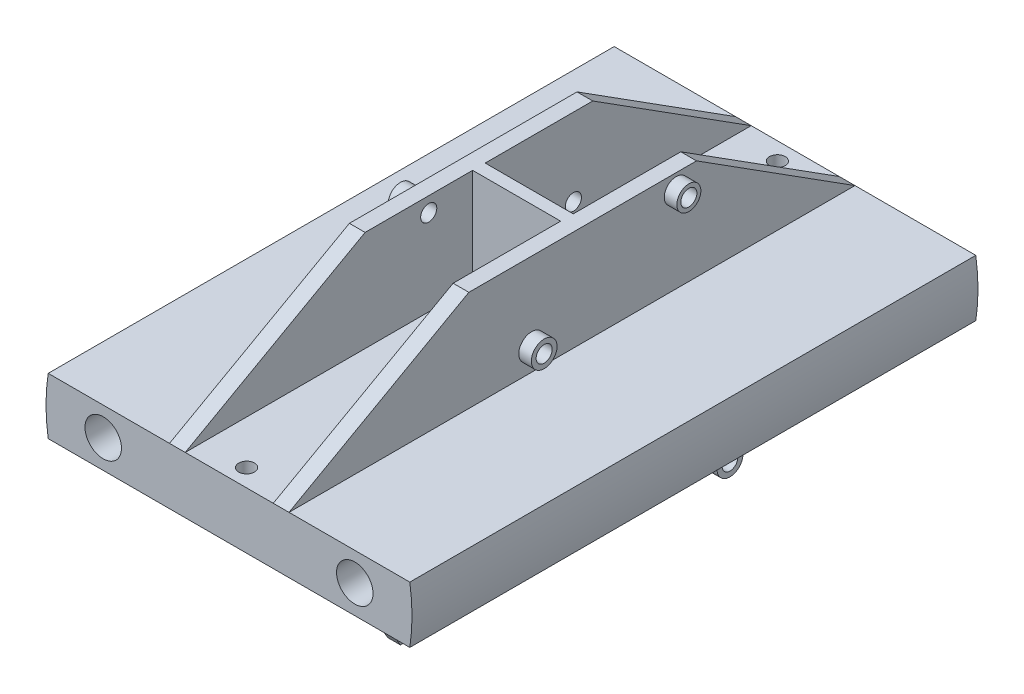
from build123d import *

# Parameters (mm, degrees)
SKETCH1_R            = 5.715
SKETCH1_R_2          = 3.683
BOSS_EXTRUDE2_DEPTH  = 114.3
SKETCH2_W            = 3.175
SKETCH2_H            = 45.974
BOSS_EXTRUDE3_DEPTH  = 20.32
SKETCH8_W            = 17.78
SKETCH8_H            = 2.54
BOSS_EXTRUDE6_DEPTH  = 20.32
BOSS_EXTRUDE9_DEPTH  = 20.32
CUT_EXTRUDE5_REACH   = 130.614
SKETCH10_R           = 1.5875
CUT_EXTRUDE6_REACH   = 126.596
SKETCH13_R           = 1.5875
BOSS_EXTRUDE14_DEPTH = 3.175
BOSS_EXTRUDE15_DEPTH = 3.175
BOSS_EXTRUDE16_START = 5.08
SKETCH12_R           = 2.590347575
SKETCH12_R_2         = 1.5875
SKETCH12_R_3         = 2.612210891
BOSS_EXTRUDE16_DEPTH = 5.08
CHAMFER1_SIZE        = 2.54
SKETCH21_R           = 1.6256
CUT_EXTRUDE7_DEPTH   = 5.08
SKETCH22_R           = 1.6256
CUT_EXTRUDE8_DEPTH   = 5.08
BOSS_EXTRUDE17_START = 2.54
SKETCH23_R           = 2.426614549
SKETCH23_R_2         = 1.6256
SKETCH23_R_3         = 2.598483989
BOSS_EXTRUDE17_DEPTH = 2.54
BOSS_EXTRUDE18_START = 2.54
SKETCH24_R           = 2.467964506
SKETCH24_R_2         = 1.6256
SKETCH24_R_3         = 2.533270714
BOSS_EXTRUDE18_DEPTH = 2.54
SKETCH25_R           = 48.771557558
SKETCH25_R_2         = 36.957
CUT_EXTRUDE9_DEPTH   = 124.263624906
CUT_EXTRUDE10_DEPTH  = 129.148442846


with BuildPart() as part:
    # Sketch1 → Boss-Extrude2 (new body)
    # profile 1 of 8: a face of its own
    with BuildSketch(Plane.XY):
        with BuildLine():
            Line((25.4, 5.715), (-25.4, 5.715))
            ThreePointArc((-25.4, 5.715), (-21.358884746, 4.041115254), (-19.685, 0))
            Line((-19.685, 0), (19.685, 0))
            ThreePointArc((19.685, 0), (21.358884746, 4.041115254), (25.4, 5.715))
        make_face()
    # profile 2 of 8: a face of its own
    with BuildSketch(Plane.XY):
        with Locations((-25.4, 0)):
            Circle(SKETCH1_R)
        with Locations((-25.4, 0)):
            Circle(SKETCH1_R_2, mode=Mode.SUBTRACT)
    # profile 3 of 8: a face of its own
    with BuildSketch(Plane.XY):
        with Locations((25.4, 0)):
            Circle(SKETCH1_R)
        with Locations((25.4, 0)):
            Circle(SKETCH1_R_2, mode=Mode.SUBTRACT)
    # profile 4 of 8: a face of its own
    with BuildSketch(Plane.XY):
        with BuildLine():
            ThreePointArc((-31.115, 0), (-29.441115254, 4.041115254), (-25.4, 5.715))
            Line((-25.4, 5.715), (-37.668936473, 5.715))
            ThreePointArc((-37.668936473, 5.715), (-37.992081278, 2.865616895), (-38.1, 0))
            Line((-38.1, 0), (-31.115, 0))
        make_face()
    # profile 5 of 8: a face of its own
    with BuildSketch(Plane.XY):
        with BuildLine():
            Line((37.668936473, 5.715), (25.4, 5.715))
            ThreePointArc((25.4, 5.715), (29.441115254, 4.041115254), (31.115, 0))
            Line((31.115, 0), (38.1, 0))
            ThreePointArc((38.1, 0), (37.992081278, 2.865616895), (37.668936473, 5.715))
        make_face()
    # profile 6 of 8: a face of its own
    with BuildSketch(Plane.XY):
        with BuildLine():
            Line((38.1, 0), (31.115, 0))
            ThreePointArc((31.115, 0), (29.441115254, -4.041115254), (25.4, -5.715))
            Line((25.4, -5.715), (37.668936473, -5.715))
            ThreePointArc((37.668936473, -5.715), (37.992081278, -2.865616895), (38.1, 0))
        make_face()
    # profile 7 of 8: a face of its own
    with BuildSketch(Plane.XY):
        with BuildLine():
            Line((19.685, 0), (-19.685, 0))
            ThreePointArc((-19.685, 0), (-21.358884746, -4.041115254), (-25.4, -5.715))
            Line((-25.4, -5.715), (25.4, -5.715))
            ThreePointArc((25.4, -5.715), (21.358884746, -4.041115254), (19.685, 0))
        make_face()
    # profile 8 of 8: a face of its own
    with BuildSketch(Plane.XY):
        with BuildLine():
            ThreePointArc((-25.4, -5.715), (-29.441115254, -4.041115254), (-31.115, 0))
            Line((-31.115, 0), (-38.1, 0))
            ThreePointArc((-38.1, 0), (-37.992081278, -2.865616895), (-37.668936473, -5.715))
            Line((-37.668936473, -5.715), (-25.4, -5.715))
        make_face()
    extrude(amount=BOSS_EXTRUDE2_DEPTH)

    # Sketch2 → Boss-Extrude3 (add)
    with BuildSketch(Plane(origin=(0, 5.715, 0), x_dir=(1, 0, 0), z_dir=(0, 1, 0))):
        with Locations((-10.427436473, -54.991)):
            Rectangle(SKETCH2_W, SKETCH2_H)
        with Locations((10.527563527, -54.991)):
            Rectangle(SKETCH2_W, SKETCH2_H)
    extrude(amount=BOSS_EXTRUDE3_DEPTH)

    # Sketch8 → Boss-Extrude6 (add)
    with BuildSketch(Plane(origin=(0, 5.715, 0), x_dir=(1, 0, 0), z_dir=(0, 1, 0))):
        with Locations((0.050063527, -54.991)):
            Rectangle(SKETCH8_W, SKETCH8_H)
    extrude(amount=BOSS_EXTRUDE6_DEPTH)

    # Sketch9 → Boss-Extrude9 (add)
    with BuildSketch(Plane.XZ.offset(5.715)):
        Polygon((12.268936473, 73.66), (12.268936473, 17.78), (14.808936473, 17.78), (14.808936473, 106.68), (12.268936473, 106.68), (12.268936473, 76.2), (-27.508936473, 76.2), (-27.508936473, 106.68), (-30.048936473, 106.68), (-30.048936473, 17.78), (-27.508936473, 17.78), (-27.508936473, 73.66), align=None)
    extrude(amount=BOSS_EXTRUDE9_DEPTH)

    # Sketch10 → Cut-Extrude5 (cut, up to next)
    with BuildSketch(Plane(origin=(14.808936473, 0, 0), x_dir=(0, 0, -1), z_dir=(1, 0, 0)), mode=Mode.PRIVATE) as cut_extrude5_sk1:
        with Locations((-58.42, -9.525)):
            Circle(SKETCH10_R)
    cut_extrude5_tool1 = extrude(cut_extrude5_sk1.sketch, amount=-CUT_EXTRUDE5_REACH, mode=Mode.PRIVATE) & part.part
    # Sketch10 → Cut-Extrude5 (cut, up to next)
    with BuildSketch(Plane(origin=(14.808936473, 0, 0), x_dir=(0, 0, -1), z_dir=(1, 0, 0)), mode=Mode.PRIVATE) as cut_extrude5_sk2:
        with Locations((-33.02, -22.225)):
            Circle(SKETCH10_R)
    cut_extrude5_tool2 = extrude(cut_extrude5_sk2.sketch, amount=-CUT_EXTRUDE5_REACH, mode=Mode.PRIVATE) & part.part
    add(cut_extrude5_tool1.solids().sort_by_distance((14.808936, -9.525, 58.42))[0], mode=Mode.SUBTRACT)
    add(cut_extrude5_tool2.solids().sort_by_distance((14.808936, -22.225, 33.02))[0], mode=Mode.SUBTRACT)

    # Sketch13 → Cut-Extrude6 (cut, up to next)
    with BuildSketch(Plane.XZ.offset(5.715), mode=Mode.PRIVATE) as cut_extrude6_sk1:
        with Locations(Location((0, 110.744, 0), (0, 0, 270))):
            Circle(SKETCH13_R)
    cut_extrude6_tool1 = extrude(cut_extrude6_sk1.sketch, amount=-CUT_EXTRUDE6_REACH, mode=Mode.PRIVATE) & part.part
    # Sketch13 → Cut-Extrude6 (cut, up to next)
    with BuildSketch(Plane.XZ.offset(5.715), mode=Mode.PRIVATE) as cut_extrude6_sk2:
        with Locations(Location((0, 3.556, 0), (0, 0, 270))):
            Circle(SKETCH13_R)
    cut_extrude6_tool2 = extrude(cut_extrude6_sk2.sketch, amount=-CUT_EXTRUDE6_REACH, mode=Mode.PRIVATE) & part.part
    add(cut_extrude6_tool1.solids().sort_by_distance((0, -5.715, 110.744))[0], mode=Mode.SUBTRACT)
    add(cut_extrude6_tool2.solids().sort_by_distance((0, -5.715, 3.556))[0], mode=Mode.SUBTRACT)

    # Sketch18 → Boss-Extrude14 (add)
    with BuildSketch(Plane.ZY.offset(12.014936473)):
        Polygon((77.978, 5.715), (77.978, 26.035), (114.3, 5.715), align=None)
        Polygon((32.004, 26.035), (32.004, 5.715), (0, 5.715), align=None)
    extrude(amount=-BOSS_EXTRUDE14_DEPTH)

    # Sketch19 → Boss-Extrude15 (add)
    with BuildSketch(Plane(origin=(12.115063527, 0, 0), x_dir=(0, 0, -1), z_dir=(1, 0, 0))):
        Polygon((-32.004, 26.035), (0, 5.715), (-32.004, 5.715), align=None)
        Polygon((-77.978, 5.715), (-114.3, 5.715), (-77.978, 26.035), align=None)
    extrude(amount=-BOSS_EXTRUDE15_DEPTH)

    # Sketch12 → Boss-Extrude16 (add)
    # profile 1 of 2: a face of its own
    with BuildSketch(Plane(origin=(14.808936473, 0, 0), x_dir=(0, 0, -1), z_dir=(1, 0, 0)).offset(BOSS_EXTRUDE16_START)):
        with Locations(Location((-58.42, -9.525, 0), (0, 0, 180))):
            Circle(SKETCH12_R)
        with Locations((-58.42, -9.525)):
            Circle(SKETCH12_R_2, mode=Mode.SUBTRACT)
    # profile 2 of 2: a face of its own
    with BuildSketch(Plane(origin=(14.808936473, 0, 0), x_dir=(0, 0, -1), z_dir=(1, 0, 0)).offset(BOSS_EXTRUDE16_START)):
        with Locations(Location((-33.02, -22.225, 0), (0, 0, 180))):
            Circle(SKETCH12_R_3)
        with Locations((-33.02, -22.225)):
            Circle(SKETCH12_R_2, mode=Mode.SUBTRACT)
    extrude(amount=-BOSS_EXTRUDE16_DEPTH)

    # Chamfer1
    chamfer1_edges = [part.edges().sort_by_distance(p)[0] for p in [
        (-30.048936473, -26.035, 62.23),
    ]]
    chamfer(chamfer1_edges, length=CHAMFER1_SIZE)

    # Sketch21 → Cut-Extrude7 (cut)
    with BuildSketch(Plane.ZY.offset(12.014936473)):
        with Locations((65.125187458, 23.037602192)):
            Circle(SKETCH21_R)
        with Locations((35.915187458, 10.337602192)):
            Circle(SKETCH21_R)
    extrude(amount=-CUT_EXTRUDE7_DEPTH, mode=Mode.SUBTRACT)

    # Sketch22 → Cut-Extrude8 (cut)
    with BuildSketch(Plane(origin=(12.115063527, 0, 0), x_dir=(0, 0, -1), z_dir=(1, 0, 0))):
        with Locations((-36.092684175, 22.91159358)):
            Circle(SKETCH22_R)
        with Locations((-65.302684175, 10.21159358)):
            Circle(SKETCH22_R)
    extrude(amount=-CUT_EXTRUDE8_DEPTH, mode=Mode.SUBTRACT)

    # Sketch23 → Boss-Extrude17 (add)
    # profile 1 of 2: a face of its own
    with BuildSketch(Plane(origin=(12.115063527, 0, 0), x_dir=(0, 0, -1), z_dir=(1, 0, 0)).offset(BOSS_EXTRUDE17_START)):
        with Locations(Location((-36.092684175, 22.91159358, 0), (0, 0, 180))):
            Circle(SKETCH23_R)
        with Locations((-36.092684175, 22.91159358)):
            Circle(SKETCH23_R_2, mode=Mode.SUBTRACT)
    # profile 2 of 2: a face of its own
    with BuildSketch(Plane(origin=(12.115063527, 0, 0), x_dir=(0, 0, -1), z_dir=(1, 0, 0)).offset(BOSS_EXTRUDE17_START)):
        with Locations(Location((-65.302684175, 10.21159358, 0), (0, 0, 180))):
            Circle(SKETCH23_R_3)
        with Locations((-65.302684175, 10.21159358)):
            Circle(SKETCH23_R_2, mode=Mode.SUBTRACT)
    extrude(amount=-BOSS_EXTRUDE17_DEPTH)

    # Sketch24 → Boss-Extrude18 (add)
    # profile 1 of 2: a face of its own
    with BuildSketch(Plane.ZY.offset(12.014936473).offset(BOSS_EXTRUDE18_START)):
        with Locations(Location((65.125187458, 23.037602192, 0), (0, 0, 180))):
            Circle(SKETCH24_R)
        with Locations((65.125187458, 23.037602192)):
            Circle(SKETCH24_R_2, mode=Mode.SUBTRACT)
    # profile 2 of 2: a face of its own
    with BuildSketch(Plane.ZY.offset(12.014936473).offset(BOSS_EXTRUDE18_START)):
        with Locations(Location((35.915187458, 10.337602192, 0), (0, 0, 180))):
            Circle(SKETCH24_R_3)
        with Locations((35.915187458, 10.337602192)):
            Circle(SKETCH24_R_2, mode=Mode.SUBTRACT)
    extrude(amount=-BOSS_EXTRUDE18_DEPTH)

    # Sketch25 → Cut-Extrude9 (cut, through all)
    with BuildSketch(Plane(origin=(0, 0, 0), x_dir=(-1, 0, 0), z_dir=(0, 0, -1))):
        Circle(SKETCH25_R)
        Circle(SKETCH25_R_2, mode=Mode.SUBTRACT)
    extrude(amount=-CUT_EXTRUDE9_DEPTH, mode=Mode.SUBTRACT)

    # Sketch26 → Cut-Extrude10 (cut, through all)
    with BuildSketch(Plane(origin=(14.808936473, 0, 0), x_dir=(0, 0, -1), z_dir=(1, 0, 0))):
        Polygon((-29.972, -26.035), (-17.78, -5.715), (-17.78, -26.035), align=None)
        Polygon((-106.68, -5.715), (-106.68, -26.035), (-94.488, -26.035), align=None)
    extrude(amount=-CUT_EXTRUDE10_DEPTH, mode=Mode.SUBTRACT)


solid = part.part
